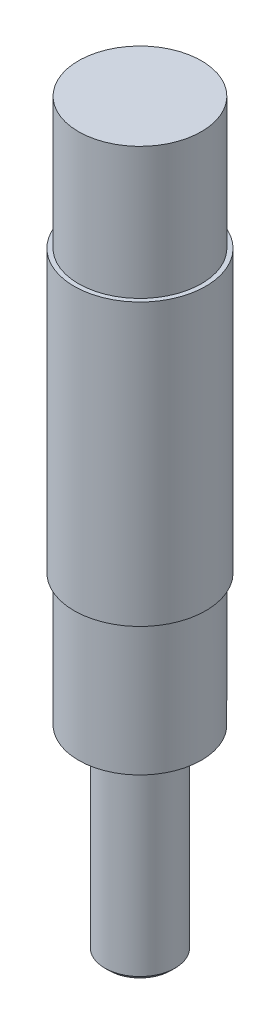
from build123d import *

# Parameters (mm, degrees)
SKETCH1_R           = 7.5
BOSS_EXTRUDE1_DEPTH = 32
SKETCH2_R           = 7
BOSS_EXTRUDE2_DEPTH = 15
BOSS_EXTRUDE3_START = 15
SKETCH3_R           = 7
BOSS_EXTRUDE3_DEPTH = 15
SKETCH4_R           = 4
BOSS_EXTRUDE4_DEPTH = 22.5
CHAMFER1_SIZE       = 0.5


with BuildPart() as part:
    # Sketch1 → Boss-Extrude1 (new body)
    with BuildSketch(Plane(origin=(0, 0, 0), x_dir=(1, 0, 0), z_dir=(0, 1, 0))):
        with Locations(Location((0, 0, 0), (0, 0, 270))):
            Circle(SKETCH1_R)
    extrude(amount=BOSS_EXTRUDE1_DEPTH)

    # Sketch2 → Boss-Extrude2 (add)
    with BuildSketch(Plane(origin=(0, 32, 0), x_dir=(1, 0, 0), z_dir=(0, 1, 0))):
        with Locations(Location((0, 0, 0), (0, 0, 270))):
            Circle(SKETCH2_R)
    extrude(amount=BOSS_EXTRUDE2_DEPTH)

    # Sketch3 → Boss-Extrude3 (add)
    with BuildSketch(Plane.XZ.offset(BOSS_EXTRUDE3_START)):
        with Locations(Location((0, 0, 0), (0, 0, 90))):
            Circle(SKETCH3_R)
    extrude(amount=-BOSS_EXTRUDE3_DEPTH)

    # Sketch4 → Boss-Extrude4 (add)
    with BuildSketch(Plane.XZ.offset(15)):
        with Locations(Location((0, 0, 0), (0, 0, 90))):
            Circle(SKETCH4_R)
    extrude(amount=BOSS_EXTRUDE4_DEPTH)

    # Chamfer1
    chamfer1_edges = [part.edges().sort_by_distance(p)[0] for p in [
        (0, -37.5, -4),
    ]]
    chamfer(chamfer1_edges, length=CHAMFER1_SIZE)


solid = part.part
